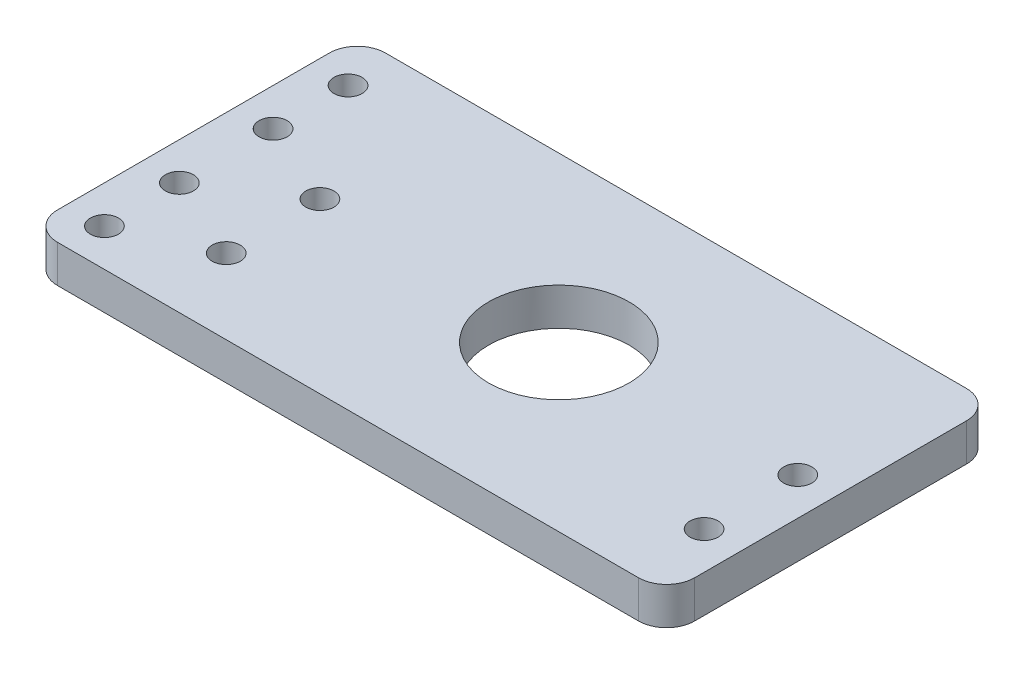
from build123d import *

# Parameters (mm, degrees)
SKETCH_1_W          = 68
SKETCH_1_H          = 35
SKETCH_1_R          = 1.5
EXTRUDE_1_DEPTH     = 4
FILLET_1_R          = 3
SKETCH_2_R          = 1.5
SKETCH_2_R_2        = 7.5
CUT_EXTRUDE_1_DEPTH = 10


with BuildPart() as part:
    # 草图1 → 凸台-拉伸1 (new body)
    with BuildSketch(Plane(origin=(0, 0, 0), x_dir=(1, 0, 0), z_dir=(0, 1, 0))):
        Rectangle(SKETCH_1_W, SKETCH_1_H)
        with Locations(Location((-30, 12.5, 0), (0, 0, 270))):
            Circle(SKETCH_1_R, mode=Mode.SUBTRACT)
        with Locations(Location((-30, 4.5, 0), (0, 0, 270))):
            Circle(SKETCH_1_R, mode=Mode.SUBTRACT)
        with Locations(Location((-30, -5.5, 0), (0, 0, 270))):
            Circle(SKETCH_1_R, mode=Mode.SUBTRACT)
        with Locations(Location((-30, -13.5, 0), (0, 0, 270))):
            Circle(SKETCH_1_R, mode=Mode.SUBTRACT)
    extrude(amount=EXTRUDE_1_DEPTH)

    # 圆角1
    fillet_1_edges = [part.edges().sort_by_distance(p)[0] for p in [
        (34, 2, 17.5),
        (-34, 2, 17.5),
        (-34, 2, -17.5),
        (34, 2, -17.5),
    ]]
    fillet(fillet_1_edges, radius=FILLET_1_R)

    # 草图2 → 切除-拉伸1 (cut)
    with BuildSketch(Plane(origin=(0, 4, 0), x_dir=(1, 0, 0), z_dir=(0, 1, 0))):
        with Locations(Location((-21, 0.5, 0), (0, 0, 270))):
            Circle(SKETCH_2_R)
        with Locations(Location((30, 0.5, 0), (0, 0, 270))):
            Circle(SKETCH_2_R)
        with Locations(Location((-21, -9.5, 0), (0, 0, 270))):
            Circle(SKETCH_2_R)
        with Locations(Location((30, -9.5, 0), (0, 0, 270))):
            Circle(SKETCH_2_R)
        with Locations(Location((5, 0, 0), (0, 0, 270))):
            Circle(SKETCH_2_R_2)
    extrude(amount=-CUT_EXTRUDE_1_DEPTH, mode=Mode.SUBTRACT)


solid = part.part
